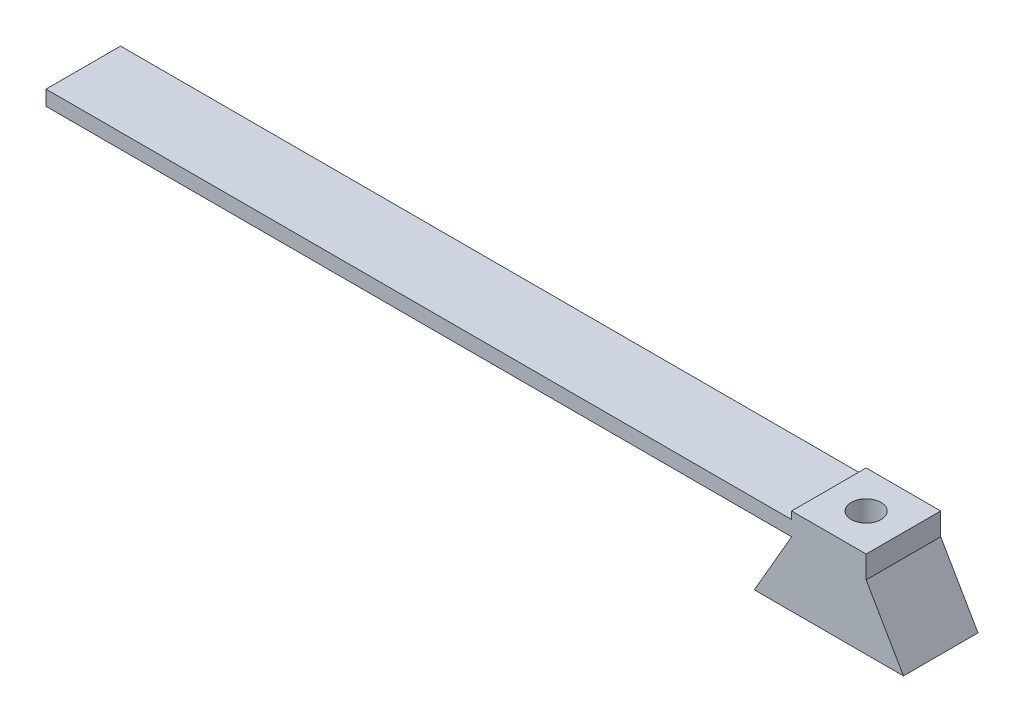
from build123d import *

# Parameters (mm, degrees)
SALIENTE_EXTRUIR1_DEPTH = 100
CROQUIS2_W              = 100
CROQUIS2_H              = 100
SALIENTE_EXTRUIR2_DEPTH = 20
CROQUIS3_W              = 100
CROQUIS3_H              = 20
SALIENTE_EXTRUIR3_DEPTH = 1000
CROQUIS4_W              = 100
CROQUIS4_H              = 100
CROQUIS4_R              = 20
SALIENTE_EXTRUIR4_DEPTH = 10
CROQUIS7_R              = 20
CORTAR_EXTRUIR2_DEPTH   = 228.5


with BuildPart() as part:
    # Croquis1 → Saliente-Extruir1 (new body)
    with BuildSketch(Plane.XY):
        Polygon((0, 0), (50, 86.602540378), (150, 86.602540378), (200, 0), align=None)
    extrude(amount=SALIENTE_EXTRUIR1_DEPTH)

    # Croquis2 → Saliente-Extruir2 (add)
    with BuildSketch(Plane(origin=(0, 86.602540378, 0), x_dir=(1, 0, 0), z_dir=(0, 1, 0))):
        with Locations((100, -50)):
            Rectangle(CROQUIS2_W, CROQUIS2_H)
    extrude(amount=SALIENTE_EXTRUIR2_DEPTH)

    # Croquis3 → Saliente-Extruir3 (add)
    with BuildSketch(Plane.ZY.offset(-50)):
        with Locations((50, 96.602540378)):
            Rectangle(CROQUIS3_W, CROQUIS3_H)
    extrude(amount=SALIENTE_EXTRUIR3_DEPTH)

    # Croquis4 → Saliente-Extruir4 (add)
    with BuildSketch(Plane(origin=(0, 106.602540378, 0), x_dir=(1, 0, 0), z_dir=(0, 1, 0))):
        with Locations((100, -50)):
            Rectangle(CROQUIS4_W, CROQUIS4_H)
        with Locations(Location((100, -50, 0), (0, 0, 270))):
            Circle(CROQUIS4_R, mode=Mode.SUBTRACT)
    extrude(amount=SALIENTE_EXTRUIR4_DEPTH)

    # Croquis7 → Cortar-Extruir2 (cut, symmetric)
    with BuildSketch(Plane(origin=(0, 116.602540378, 0), x_dir=(1, 0, 0), z_dir=(0, 1, 0))):
        with Locations(Location((100, -50, 0), (0, 0, 270))):
            Circle(CROQUIS7_R)
    extrude(amount=CORTAR_EXTRUIR2_DEPTH, both=True, mode=Mode.SUBTRACT)


solid = part.part
